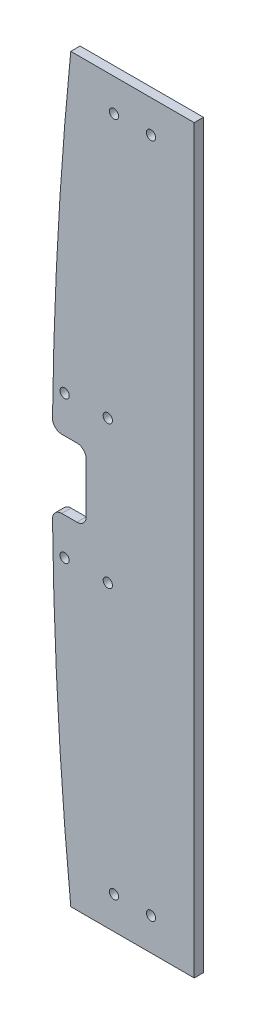
from build123d import *

# Parameters (mm, degrees)
MODEL_R         = 1.5
EXTRUDE_1_DEPTH = 3


with BuildPart() as part:
    # Model → 凸台-拉伸1 (new body)
    with BuildSketch(Plane.XY):
        with BuildLine():
            Line((2493.366322478, 1849.391249913), (2493.366322478, 1609.391249913))
            Line((2493.366322478, 1609.391249913), (2453.366322478, 1609.391249913))
            ThreePointArc((2453.366322478, 1609.391249913), (2449.24094139, 1662.258404711), (2447.449369938, 1715.255999913))
            ThreePointArc((2447.449369938, 1715.255999913), (2448.315416133, 1717.400070674), (2450.449162837, 1718.291249913))
            Line((2450.449162837, 1718.291249913), (2455.366322478, 1718.291249913))
            ThreePointArc((2455.366322478, 1718.291249913), (2457.487642822, 1719.16992957), (2458.366322478, 1721.291249913))
            Line((2458.366322478, 1721.291249913), (2458.366322478, 1737.491249913))
            ThreePointArc((2458.366322478, 1737.491249913), (2457.487642822, 1739.612570257), (2455.366322478, 1740.491249913))
            Line((2455.366322478, 1740.491249913), (2450.449162837, 1740.491249913))
            ThreePointArc((2450.449162837, 1740.491249913), (2448.315416133, 1741.382429153), (2447.449369938, 1743.526499913))
            ThreePointArc((2447.449369938, 1743.526499913), (2449.24094139, 1796.524095116), (2453.366322478, 1849.391249913))
            Line((2453.366322478, 1849.391249913), (2493.366322478, 1849.391249913))
        make_face()
        with Locations((2479.366322478, 1619.891249913)):
            Circle(MODEL_R, mode=Mode.SUBTRACT)
        with Locations((2467.366322478, 1619.891249913)):
            Circle(MODEL_R, mode=Mode.SUBTRACT)
        with Locations((2467.366322478, 1838.891249913)):
            Circle(MODEL_R, mode=Mode.SUBTRACT)
        with Locations((2479.366322478, 1838.891249913)):
            Circle(MODEL_R, mode=Mode.SUBTRACT)
        with Locations((2465.366322478, 1752.491249913)):
            Circle(MODEL_R, mode=Mode.SUBTRACT)
        with Locations((2465.366322478, 1706.291249913)):
            Circle(MODEL_R, mode=Mode.SUBTRACT)
        with Locations((2451.366322478, 1706.291249913)):
            Circle(MODEL_R, mode=Mode.SUBTRACT)
        with Locations((2451.366322478, 1752.491249913)):
            Circle(MODEL_R, mode=Mode.SUBTRACT)
    extrude(amount=EXTRUDE_1_DEPTH)


solid = part.part
